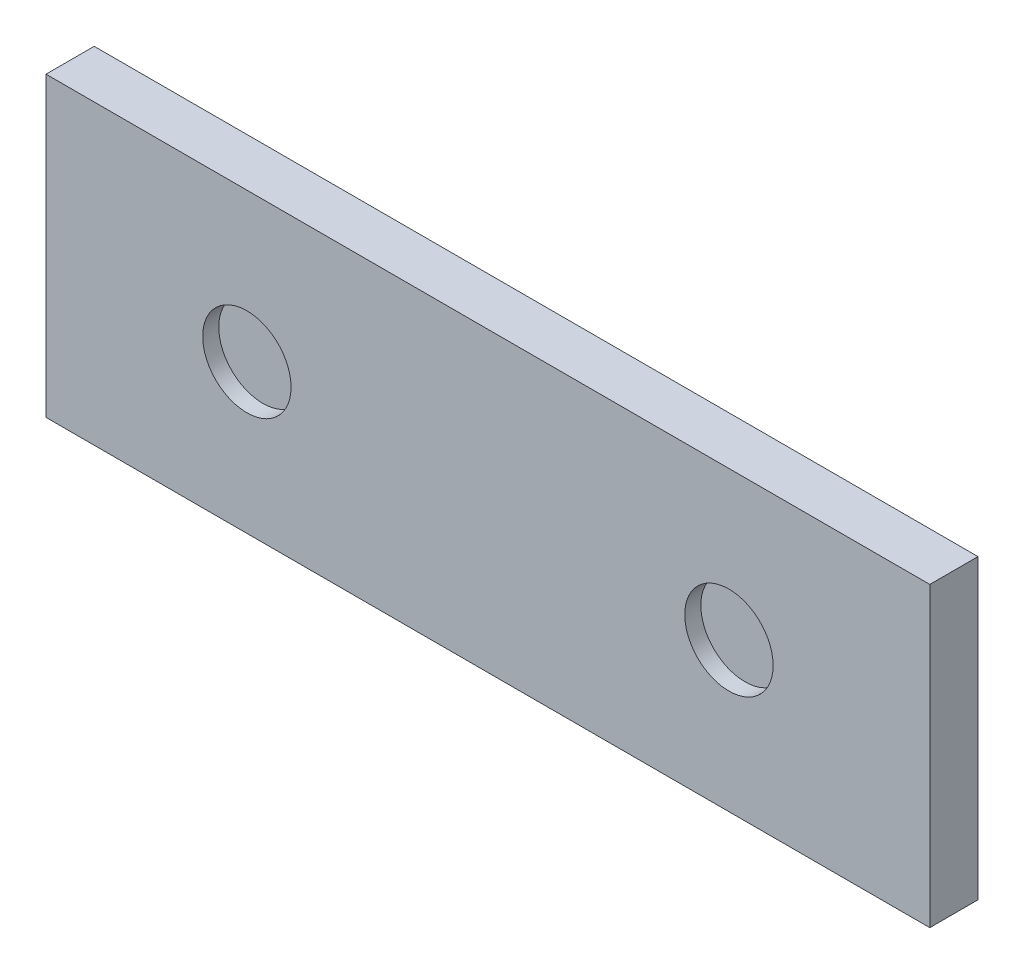
from build123d import *

# Parameters (mm, degrees)
SKETCH1_W           = 55
SKETCH1_H           = 18.5
BOSS_EXTRUDE1_DEPTH = 1.5
SKETCH2_R           = 2.75
CUT_EXTRUDE1_DEPTH  = 1


with BuildPart() as part:
    # Sketch1 → Boss-Extrude1 (new, symmetric)
    with BuildSketch(Plane.XY):
        Rectangle(SKETCH1_W, SKETCH1_H)
    extrude(amount=BOSS_EXTRUDE1_DEPTH, both=True)

    # Sketch2 → Cut-Extrude1 (cut)
    with BuildSketch(Plane.XY.offset(1.5)):
        with Locations((-15, 0)):
            Circle(SKETCH2_R)
        with Locations((15, 0)):
            Circle(SKETCH2_R)
    extrude(amount=-CUT_EXTRUDE1_DEPTH, mode=Mode.SUBTRACT)


solid = part.part
